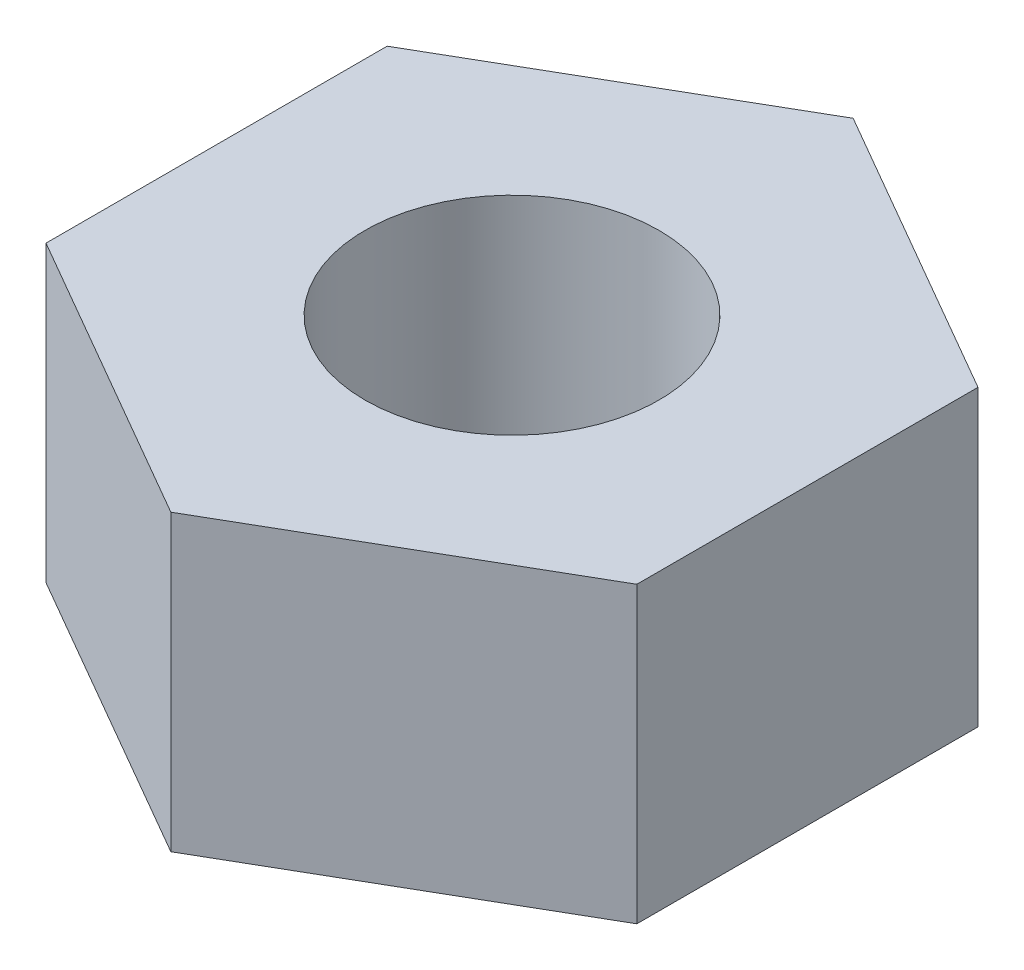
from build123d import *

# Parameters (mm, degrees)
SKETCH1_R           = 3.175
BOSS_EXTRUDE1_DEPTH = 6.35


with BuildPart() as part:
    # Sketch1 → Boss-Extrude1 (new body)
    with BuildSketch(Plane(origin=(0, 0, 0), x_dir=(1, 0, 0), z_dir=(0, 1, 0))):
        Polygon((0, -7.366), (6.379143124, -3.683), (6.379143124, 3.683), (0, 7.366), (-6.379143124, 3.683), (-6.379143124, -3.683), align=None)
        with Locations(Location((0, 0, 0), (0, 0, 270))):
            Circle(SKETCH1_R, mode=Mode.SUBTRACT)
    extrude(amount=BOSS_EXTRUDE1_DEPTH)


solid = part.part
